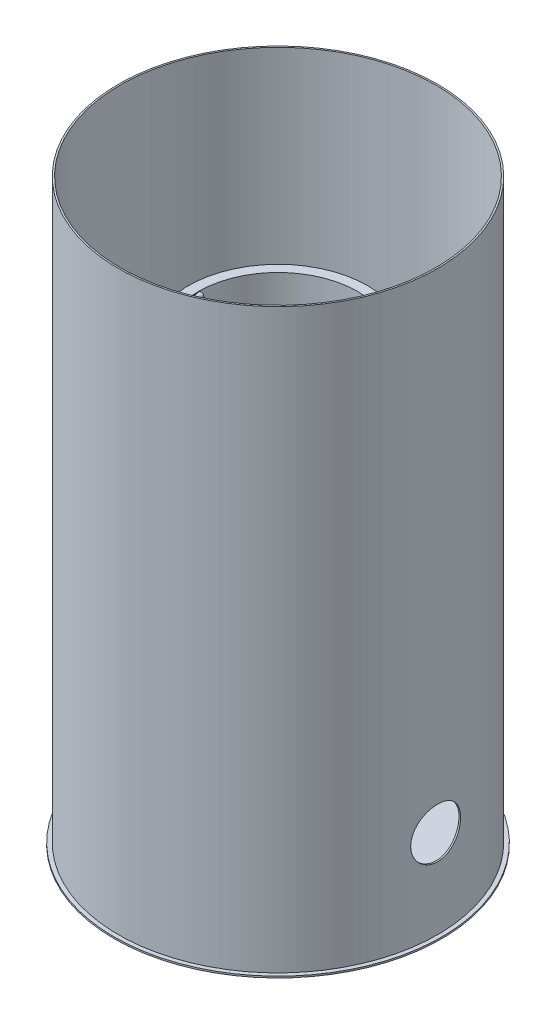
from build123d import *

# Parameters (mm, degrees)
SKETCH2_W          = 6.35
SKETCH2_H          = 228.6
SWEEP1_PITCH       = 24.13
SWEEP1_HEIGHT      = 217.17
SWEEP1_RADIUS      = 49.022
SWEEP1_START_ANGLE = -90
SKETCH7_R          = 15.875
CUT_EXTRUDE1_DEPTH = 397.65497501


with BuildPart() as part:
    # Sketch1 → Revolve1 (revolve)
    with BuildSketch(Plane.XY, mode=Mode.PRIVATE) as revolve1_sk:
        Polygon((0, 0), (104.14, 0), (104.14, 1.016), (101.6, 1.016), (101.6, 368.3), (100.584, 368.3), (100.584, 1.016), (0, 1.016), align=None)
    revolve(revolve1_sk.sketch.rotate(Axis((0, -2692.159885707, 0), (0, 1, 0)), 90), axis=Axis((0, -2692.159885707, 0), (0, 1, 0)))

    # Sketch7 → Cut-Extrude1 (cut, through all)
    with BuildSketch(Plane(origin=(0, 0, 0), x_dir=(0, 0, -1), z_dir=(1, 0, 0))):
        with Locations(Location((0, 57.15, 0), (0, 0, 180))):
            Circle(SKETCH7_R)
    extrude(amount=CUT_EXTRUDE1_DEPTH, mode=Mode.SUBTRACT)


with BuildPart() as body_2:
    # Sketch2 → Revolve2 (revolve)
    with BuildSketch(Plane.XY, mode=Mode.PRIVATE) as revolve2_sk:
        with Locations((53.975, 165.1)):
            Rectangle(SKETCH2_W, SKETCH2_H)
    revolve(revolve2_sk.sketch.rotate(Axis((0, -937.283298013, 0), (0, 1, 0)), 90), axis=Axis((0, -937.283298013, 0), (0, 1, 0)))


with BuildPart() as body_3:
    # Sweep1: sweep along a helix
    with BuildLine() as sweep1_path:
        add(Helix(SWEEP1_PITCH, SWEEP1_HEIGHT, SWEEP1_RADIUS, center=(0, 57.15, 0), direction=(0, 1, 0), lefthand=True, mode=Mode.PRIVATE).rotate(Axis((0, 57.15, 0), (0, 1, 0)), SWEEP1_START_ANGLE))
    # Sketch3 → Sweep1 (sweep)
    with BuildSketch(Plane.XY):
        with BuildLine():
            Line((-47.244, 61.087), (-47.244, 53.213))
            ThreePointArc((-47.244, 53.213), (-49.022, 51.435), (-50.8, 53.213))
            Line((-50.8, 53.213), (-50.8, 61.087))
            ThreePointArc((-50.8, 61.087), (-49.022, 62.865), (-47.244, 61.087))
        make_face()
    sweep(path=sweep1_path.line, is_frenet=True)


solid = Compound([part.part, body_2.part, body_3.part])
